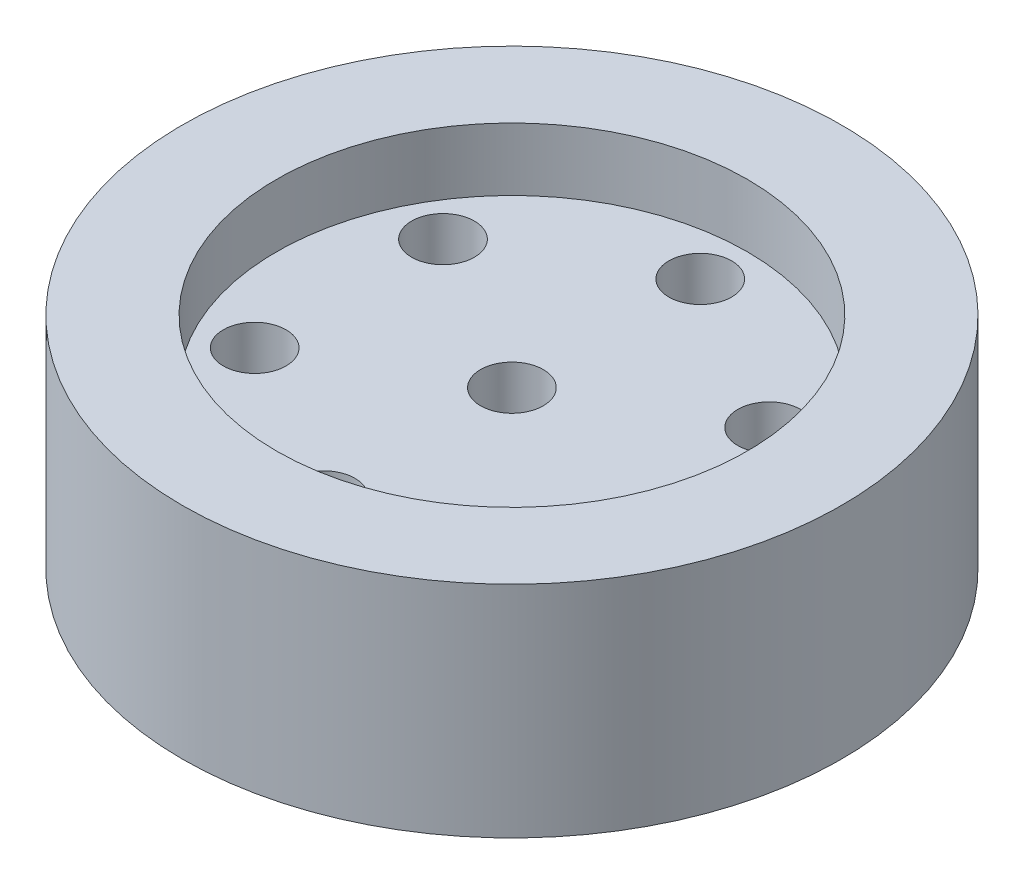
from build123d import *

# Parameters (mm, degrees)
SKETCH1_R           = 21
BOSS_EXTRUDE1_DEPTH = 7
SKETCH2_R           = 15
CUT_EXTRUDE1_DEPTH  = 4
SKETCH3_R           = 19
SKETCH3_R_2         = 5
CUT_EXTRUDE2_DEPTH  = 4
SKETCH4_R           = 2
CUT_EXTRUDE3_DEPTH  = 33.832910319
SKETCH5_R           = 2
CUT_EXTRUDE4_DEPTH  = 32.336879232


with BuildPart() as part:
    # Sketch1 → Boss-Extrude1 (new, symmetric)
    with BuildSketch(Plane(origin=(0, 0, 0), x_dir=(1, 0, 0), z_dir=(0, 1, 0))):
        with Locations(Location((0, 0, 0), (0, 0, 270))):
            Circle(SKETCH1_R)
    extrude(amount=BOSS_EXTRUDE1_DEPTH, both=True)

    # Sketch2 → Cut-Extrude1 (cut)
    with BuildSketch(Plane(origin=(0, 7, 0), x_dir=(1, 0, 0), z_dir=(0, 1, 0))):
        with Locations(Location((0, 0, 0), (0, 0, 270))):
            Circle(SKETCH2_R)
    extrude(amount=-CUT_EXTRUDE1_DEPTH, mode=Mode.SUBTRACT)

    # Sketch3 → Cut-Extrude2 (cut)
    with BuildSketch(Plane.XZ.offset(7)):
        with Locations(Location((0, 0, 0), (0, 0, 270))):
            Circle(SKETCH3_R)
        with Locations(Location((0, 0, 0), (0, 0, 270))):
            Circle(SKETCH3_R_2, mode=Mode.SUBTRACT)
    extrude(amount=-CUT_EXTRUDE2_DEPTH, mode=Mode.SUBTRACT)

    # Sketch4 → Cut-Extrude3 (cut, through all)
    with BuildSketch(Plane.XZ.offset(7)):
        with Locations(Location((0, 0, 0), (0, 0, 270))):
            Circle(SKETCH4_R)
    extrude(amount=-CUT_EXTRUDE3_DEPTH, mode=Mode.SUBTRACT)

    # Sketch5 → Cut-Extrude4 (cut, through all)
    with BuildSketch(Plane.XZ.offset(3)):
        with Locations(Location((0, 12, 0), (0, 0, 270))):
            Circle(SKETCH5_R)
        with Locations(Location((10.392304845, 6, 0), (0, 0, 270))):
            Circle(SKETCH5_R)
        with Locations(Location((10.392304845, -6, 0), (0, 0, 270))):
            Circle(SKETCH5_R)
        with Locations(Location((0, -12, 0), (0, 0, 270))):
            Circle(SKETCH5_R)
        with Locations(Location((-10.392304845, -6, 0), (0, 0, 270))):
            Circle(SKETCH5_R)
        with Locations(Location((-10.392304845, 6, 0), (0, 0, 270))):
            Circle(SKETCH5_R)
    extrude(amount=-CUT_EXTRUDE4_DEPTH, mode=Mode.SUBTRACT)


solid = part.part
